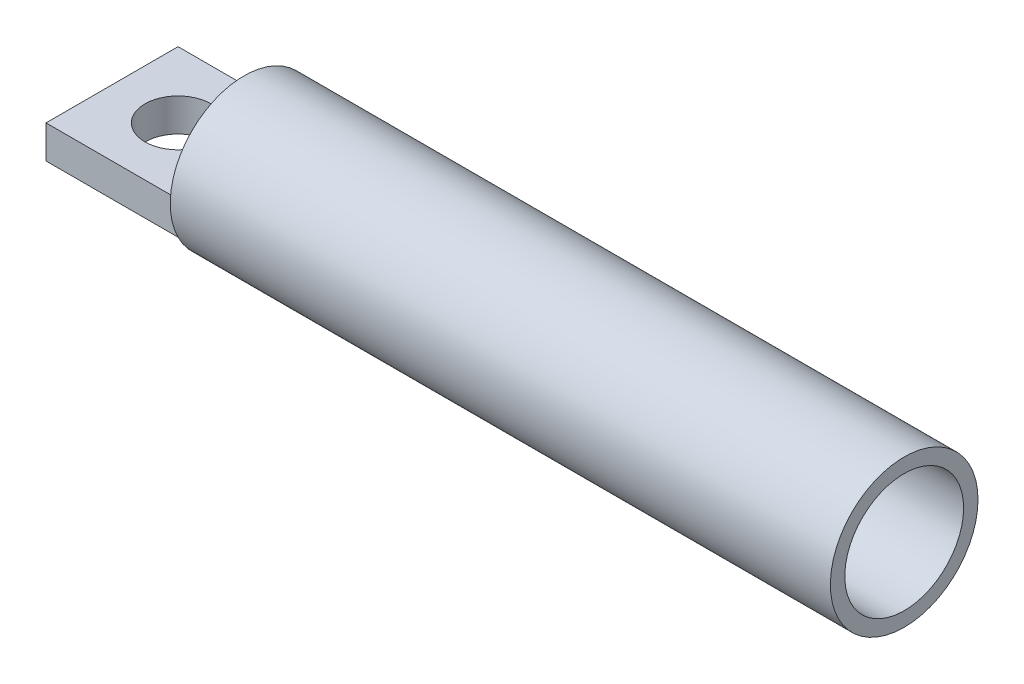
from build123d import *

# Parameters (mm, degrees)
SKETCH1_W           = 50.8
SKETCH1_H           = 50.8
SKETCH1_R           = 12.7
BOSS_EXTRUDE1_DEPTH = 12.7
SKETCH2_R           = 28.398063314
SKETCH2_R_2         = 22.86
BOSS_EXTRUDE2_DEPTH = 254
SCALE1_SCALE        = 3
SCALE2_SCALE        = 0.333333333
SCALE3_SCALE        = 2


with BuildPart() as part:
    # Sketch1 → Boss-Extrude1 (new body)
    with BuildSketch(Plane(origin=(0, 0, 0), x_dir=(1, 0, 0), z_dir=(0, 1, 0))):
        with Locations((25.4, 25.4)):
            Rectangle(SKETCH1_W, SKETCH1_H)
        with Locations(Location((25.4, 25.4, 0), (0, 0, 270))):
            Circle(SKETCH1_R, mode=Mode.SUBTRACT)
    extrude(amount=BOSS_EXTRUDE1_DEPTH)

    # Sketch2 → Boss-Extrude2 (add)
    with BuildSketch(Plane(origin=(50.8, 0, 0), x_dir=(0, 0, -1), z_dir=(1, 0, 0))):
        with Locations(Location((25.4, 12.7, 0), (0, 0, 206.565051177))):
            Circle(SKETCH2_R)
        with Locations((25.4, 12.7)):
            Circle(SKETCH2_R_2, mode=Mode.SUBTRACT)
    extrude(amount=BOSS_EXTRUDE2_DEPTH)


with BuildPart() as part_1:
    # Scale1: scaled about (161.925226112, 12.038551088, -25.4)
    add(part.part.scale(SCALE1_SCALE).moved(Location((-323.850452224, -24.077102176, 50.8))))


with BuildPart() as part_2:
    # Scale2: scaled about (161.925226113, 12.038551088, -25.4)
    add(part_1.part.scale(SCALE2_SCALE).moved(Location((107.950150742, 8.025700725, -16.933333333))))


with BuildPart() as part_3:
    # Scale3: scaled about (161.925226113, 12.038551088, -25.4)
    add(part_2.part.scale(SCALE3_SCALE).moved(Location((-161.925226113, -12.038551088, 25.4))))


solid = part_3.part
